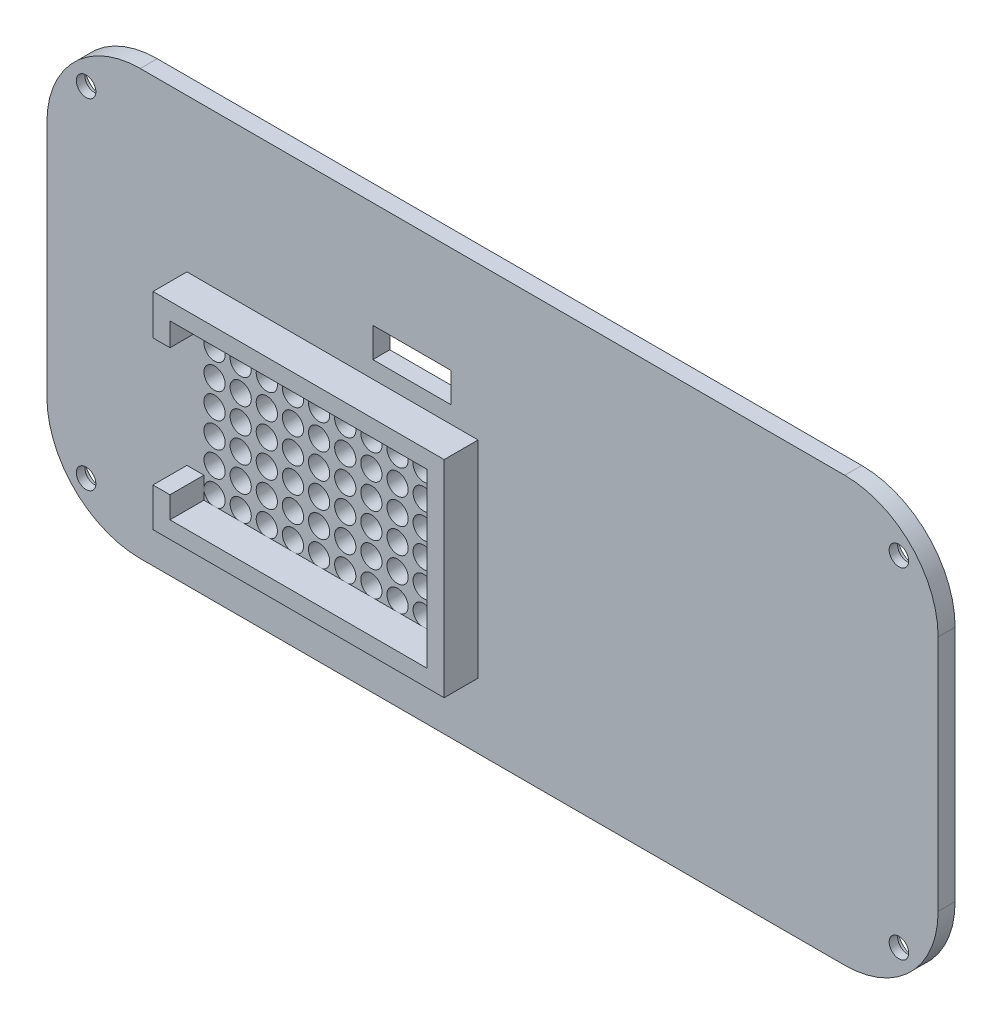
from build123d import *

# Parameters (mm, degrees)
SKETCH_1_W          = 105
SKETCH_1_H          = 50
EXTRUDE_1_DEPTH     = 2
FILLET_1_R          = 11
SKETCH_3_R          = 2.15
CUT_EXTRUDE_1_DEPTH = 1
CUT_EXTRUDE_2_REACH = 60.157
SKETCH_4_R          = 1.15
CUT_EXTRUDE_3_REACH = 60.183
SKETCH_5_W          = 9.2
SKETCH_5_H          = 3.5
SKETCH_6_W          = 34.3
SKETCH_6_H          = 24.3
SKETCH_6_W_2        = 30.3
SKETCH_6_H_2        = 20.3
EXTRUDE_1_2_DEPTH   = 4
SKETCH_7_R          = 1.25
CUT_EXTRUDE_4_DEPTH = 2
SKETCH_8_W          = 2
SKETCH_8_H          = 15
CUT_EXTRUDE_5_DEPTH = 4


with BuildPart() as part:
    # 草图1 → Extrude 1 (new body)
    with BuildSketch(Plane.XY):
        Rectangle(SKETCH_1_W, SKETCH_1_H)
    extrude(amount=EXTRUDE_1_DEPTH)

    # 圆角1
    fillet_1_edges = [part.edges().sort_by_distance(p)[0] for p in [
        (52.5, -25, 1),
        (-52.5, -25, 1),
        (-52.5, 25, 1),
        (52.5, 25, 1),
    ]]
    fillet(fillet_1_edges, radius=FILLET_1_R)

    # 草图3 → 切除-拉伸1 (cut)
    with BuildSketch(Plane(origin=(0, 0, 0), x_dir=(-1, 0, 0), z_dir=(0, 0, -1))):
        with Locations((47.88083152, -20)):
            Circle(SKETCH_3_R)
        with Locations((47.88083152, 20)):
            Circle(SKETCH_3_R)
        with Locations((-47.88083152, 20)):
            Circle(SKETCH_3_R)
        with Locations((-47.88083152, -20)):
            Circle(SKETCH_3_R)
    extrude(amount=-CUT_EXTRUDE_1_DEPTH, mode=Mode.SUBTRACT)

    # 草图4 → 切除-拉伸2 (cut, up to next)
    with BuildSketch(Plane(origin=(0, 0, 1), x_dir=(-1, 0, 0), z_dir=(0, 0, -1)), mode=Mode.PRIVATE) as cut_extrude_2_sk1:
        with Locations((47.88083152, -20)):
            Circle(SKETCH_4_R)
    cut_extrude_2_tool1 = extrude(cut_extrude_2_sk1.sketch, amount=-CUT_EXTRUDE_2_REACH, mode=Mode.PRIVATE) & part.part
    # 草图4 → 切除-拉伸2 (cut, up to next)
    with BuildSketch(Plane(origin=(0, 0, 1), x_dir=(-1, 0, 0), z_dir=(0, 0, -1)), mode=Mode.PRIVATE) as cut_extrude_2_sk2:
        with Locations((-47.88083152, -20)):
            Circle(SKETCH_4_R)
    cut_extrude_2_tool2 = extrude(cut_extrude_2_sk2.sketch, amount=-CUT_EXTRUDE_2_REACH, mode=Mode.PRIVATE) & part.part
    # 草图4 → 切除-拉伸2 (cut, up to next)
    with BuildSketch(Plane(origin=(0, 0, 1), x_dir=(-1, 0, 0), z_dir=(0, 0, -1)), mode=Mode.PRIVATE) as cut_extrude_2_sk3:
        with Locations((47.88083152, 20)):
            Circle(SKETCH_4_R)
    cut_extrude_2_tool3 = extrude(cut_extrude_2_sk3.sketch, amount=-CUT_EXTRUDE_2_REACH, mode=Mode.PRIVATE) & part.part
    # 草图4 → 切除-拉伸2 (cut, up to next)
    with BuildSketch(Plane(origin=(0, 0, 1), x_dir=(-1, 0, 0), z_dir=(0, 0, -1)), mode=Mode.PRIVATE) as cut_extrude_2_sk4:
        with Locations((-47.88083152, 20)):
            Circle(SKETCH_4_R)
    cut_extrude_2_tool4 = extrude(cut_extrude_2_sk4.sketch, amount=-CUT_EXTRUDE_2_REACH, mode=Mode.PRIVATE) & part.part
    add(cut_extrude_2_tool1.solids().sort_by_distance((-47.880832, -20, 1))[0], mode=Mode.SUBTRACT)
    add(cut_extrude_2_tool2.solids().sort_by_distance((47.880832, -20, 1))[0], mode=Mode.SUBTRACT)
    add(cut_extrude_2_tool3.solids().sort_by_distance((-47.880832, 20, 1))[0], mode=Mode.SUBTRACT)
    add(cut_extrude_2_tool4.solids().sort_by_distance((47.880832, 20, 1))[0], mode=Mode.SUBTRACT)

    # 草图5 → 切除-拉伸3 (cut, up to next)
    with BuildSketch(Plane(origin=(0, 0, 0), x_dir=(-1, 0, 0), z_dir=(0, 0, -1)), mode=Mode.PRIVATE) as cut_extrude_3_sk1:
        with Locations((9.5, 10.75)):
            Rectangle(SKETCH_5_W, SKETCH_5_H)
    cut_extrude_3_tool1 = extrude(cut_extrude_3_sk1.sketch, amount=-CUT_EXTRUDE_3_REACH, mode=Mode.PRIVATE) & part.part
    add(cut_extrude_3_tool1.solids().sort_by_distance((-9.5, 10.75, 0))[0], mode=Mode.SUBTRACT)

    # 草图6 → Extrude 1 2 (add)
    with BuildSketch(Plane.XY.offset(2)):
        with Locations((-18.85, -5.15)):
            Rectangle(SKETCH_6_W, SKETCH_6_H)
        with Locations((-18.85, -5.15)):
            Rectangle(SKETCH_6_W_2, SKETCH_6_H_2, mode=Mode.SUBTRACT)
    extrude(amount=EXTRUDE_1_2_DEPTH)

    # 草图7 → 切除-拉伸4 (cut)
    with BuildSketch(Plane.XY.offset(2)):
        with Locations(Location((-32.75, 3.75, 0), (0, 0, 180))):
            Circle(SKETCH_7_R)
        with Locations(Location((-29.67, 3.75, 0), (0, 0, 90))):
            Circle(SKETCH_7_R)
        with Locations(Location((-26.59, 3.75, 0), (0, 0, 90))):
            Circle(SKETCH_7_R)
        with Locations(Location((-23.51, 3.75, 0), (0, 0, 90))):
            Circle(SKETCH_7_R)
        with Locations(Location((-20.43, 3.75, 0), (0, 0, 90))):
            Circle(SKETCH_7_R)
        with Locations(Location((-17.35, 3.75, 0), (0, 0, 90))):
            Circle(SKETCH_7_R)
        with Locations(Location((-14.27, 3.75, 0), (0, 0, 90))):
            Circle(SKETCH_7_R)
        with Locations(Location((-11.19, 3.75, 0), (0, 0, 90))):
            Circle(SKETCH_7_R)
        with Locations(Location((-8.11, 3.75, 0), (0, 0, 90))):
            Circle(SKETCH_7_R)
        with Locations(Location((-5.03, 3.75, 0), (0, 0, 90))):
            Circle(SKETCH_7_R)
        with Locations((-29.67, 0.77)):
            Circle(SKETCH_7_R)
        with Locations((-26.59, 0.77)):
            Circle(SKETCH_7_R)
        with Locations((-23.51, 0.77)):
            Circle(SKETCH_7_R)
        with Locations((-20.43, 0.77)):
            Circle(SKETCH_7_R)
        with Locations((-17.35, 0.77)):
            Circle(SKETCH_7_R)
        with Locations((-14.27, 0.77)):
            Circle(SKETCH_7_R)
        with Locations((-11.19, 0.77)):
            Circle(SKETCH_7_R)
        with Locations((-8.11, 0.77)):
            Circle(SKETCH_7_R)
        with Locations((-5.03, 0.77)):
            Circle(SKETCH_7_R)
        with Locations((-29.67, -2.21)):
            Circle(SKETCH_7_R)
        with Locations((-26.59, -2.21)):
            Circle(SKETCH_7_R)
        with Locations((-23.51, -2.21)):
            Circle(SKETCH_7_R)
        with Locations((-20.43, -2.21)):
            Circle(SKETCH_7_R)
        with Locations((-17.35, -2.21)):
            Circle(SKETCH_7_R)
        with Locations((-14.27, -2.21)):
            Circle(SKETCH_7_R)
        with Locations((-11.19, -2.21)):
            Circle(SKETCH_7_R)
        with Locations((-8.11, -2.21)):
            Circle(SKETCH_7_R)
        with Locations((-5.03, -2.21)):
            Circle(SKETCH_7_R)
        with Locations((-29.67, -5.19)):
            Circle(SKETCH_7_R)
        with Locations((-26.59, -5.19)):
            Circle(SKETCH_7_R)
        with Locations((-23.51, -5.19)):
            Circle(SKETCH_7_R)
        with Locations((-20.43, -5.19)):
            Circle(SKETCH_7_R)
        with Locations((-17.35, -5.19)):
            Circle(SKETCH_7_R)
        with Locations((-14.27, -5.19)):
            Circle(SKETCH_7_R)
        with Locations((-11.19, -5.19)):
            Circle(SKETCH_7_R)
        with Locations((-8.11, -5.19)):
            Circle(SKETCH_7_R)
        with Locations((-5.03, -5.19)):
            Circle(SKETCH_7_R)
        with Locations((-29.67, -8.17)):
            Circle(SKETCH_7_R)
        with Locations((-26.59, -8.17)):
            Circle(SKETCH_7_R)
        with Locations((-23.51, -8.17)):
            Circle(SKETCH_7_R)
        with Locations((-20.43, -8.17)):
            Circle(SKETCH_7_R)
        with Locations((-17.35, -8.17)):
            Circle(SKETCH_7_R)
        with Locations((-14.27, -8.17)):
            Circle(SKETCH_7_R)
        with Locations((-11.19, -8.17)):
            Circle(SKETCH_7_R)
        with Locations((-8.11, -8.17)):
            Circle(SKETCH_7_R)
        with Locations((-5.03, -8.17)):
            Circle(SKETCH_7_R)
        with Locations((-29.67, -11.15)):
            Circle(SKETCH_7_R)
        with Locations((-26.59, -11.15)):
            Circle(SKETCH_7_R)
        with Locations((-23.51, -11.15)):
            Circle(SKETCH_7_R)
        with Locations((-20.43, -11.15)):
            Circle(SKETCH_7_R)
        with Locations((-17.35, -11.15)):
            Circle(SKETCH_7_R)
        with Locations((-14.27, -11.15)):
            Circle(SKETCH_7_R)
        with Locations((-11.19, -11.15)):
            Circle(SKETCH_7_R)
        with Locations((-8.11, -11.15)):
            Circle(SKETCH_7_R)
        with Locations((-5.03, -11.15)):
            Circle(SKETCH_7_R)
        with Locations(Location((-29.67, -14.13, 0), (0, 0, 290.609692938))):
            Circle(SKETCH_7_R)
        with Locations(Location((-26.59, -14.13, 0), (0, 0, 290.609692938))):
            Circle(SKETCH_7_R)
        with Locations(Location((-23.51, -14.13, 0), (0, 0, 290.609692938))):
            Circle(SKETCH_7_R)
        with Locations(Location((-20.43, -14.13, 0), (0, 0, 290.609692938))):
            Circle(SKETCH_7_R)
        with Locations(Location((-17.35, -14.13, 0), (0, 0, 290.609692938))):
            Circle(SKETCH_7_R)
        with Locations(Location((-14.27, -14.13, 0), (0, 0, 290.609692938))):
            Circle(SKETCH_7_R)
        with Locations(Location((-11.19, -14.13, 0), (0, 0, 290.609692938))):
            Circle(SKETCH_7_R)
        with Locations(Location((-8.11, -14.13, 0), (0, 0, 290.609692938))):
            Circle(SKETCH_7_R)
        with Locations(Location((-5.03, -14.13, 0), (0, 0, 290.609692938))):
            Circle(SKETCH_7_R)
        with Locations(Location((-32.75, 0.77, 0), (0, 0, 180))):
            Circle(SKETCH_7_R)
        with Locations(Location((-32.75, -2.21, 0), (0, 0, 180))):
            Circle(SKETCH_7_R)
        with Locations(Location((-32.75, -5.19, 0), (0, 0, 180))):
            Circle(SKETCH_7_R)
        with Locations(Location((-32.75, -8.17, 0), (0, 0, 180))):
            Circle(SKETCH_7_R)
        with Locations(Location((-32.75, -11.15, 0), (0, 0, 180))):
            Circle(SKETCH_7_R)
        with Locations(Location((-32.75, -14.13, 0), (0, 0, 180))):
            Circle(SKETCH_7_R)
    extrude(amount=-CUT_EXTRUDE_4_DEPTH, mode=Mode.SUBTRACT)

    # 草图8 → 切除-拉伸5 (cut)
    with BuildSketch(Plane.XY.offset(6)):
        with Locations((-35, -5.24)):
            Rectangle(SKETCH_8_W, SKETCH_8_H)
    extrude(amount=-CUT_EXTRUDE_5_DEPTH, mode=Mode.SUBTRACT)


solid = part.part
